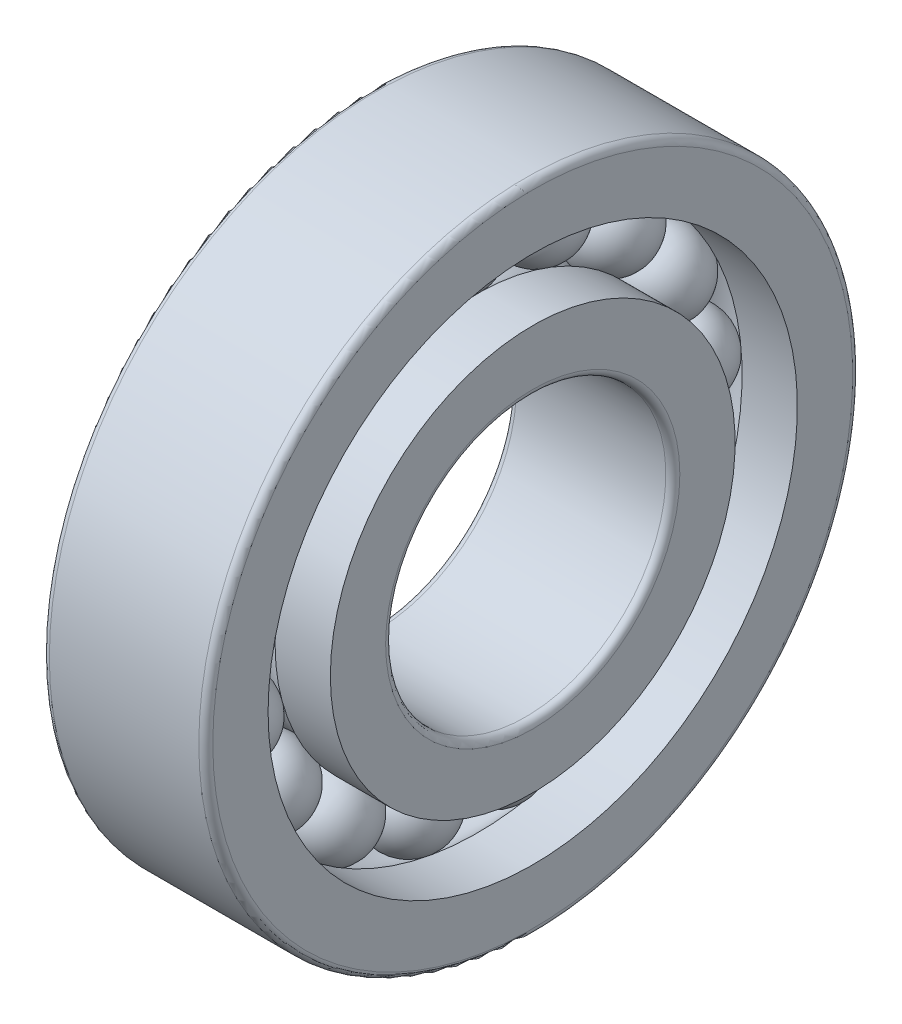
from build123d import *

# Parameters (mm, degrees)
PATTERN_CIRCULAR_5_COUNT = 17


with BuildPart() as part:
    # 草图2 → 旋转1 (revolve)
    with BuildSketch(Plane.XY):
        with BuildLine():
            Line((-3.35, 8.666666667), (-3.5, 8.666666667))
            Line((-3.5, 8.666666667), (-3.5, 8.366666667))
            Line((-3.5, 8.366666667), (-3.5, 6.3))
            ThreePointArc((-3.5, 6.3), (-3.412132034, 6.087867966), (-3.2, 6))
            Line((-3.2, 6), (3.2, 6))
            ThreePointArc((3.2, 6), (3.412132034, 6.087867966), (3.5, 6.3))
            Line((3.5, 6.3), (3.5, 8.366666667))
            Line((3.5, 8.366666667), (3.5, 8.666666667))
            Line((3.5, 8.666666667), (3.2, 8.666666667))
            Line((3.2, 8.666666667), (1.133455876, 8.666666667))
            ThreePointArc((1.133455876, 8.666666667), (0, 8.25), (-1.133455876, 8.666666667))
            Line((-1.133455876, 8.666666667), (-2.75, 8.666666667))
            Line((-2.75, 8.666666667), (-2.75, 8.366666667))
            Line((-2.75, 8.366666667), (-3.05, 8.366666667))
            Line((-3.05, 8.366666667), (-3.35, 8.666666667))
        make_face()
        with BuildLine():
            Line((-3.5, 11.333333333), (-3.35, 11.333333333))
            Line((-3.35, 11.333333333), (-3.05, 11.633333333))
            Line((-3.05, 11.633333333), (-2.75, 11.633333333))
            Line((-2.75, 11.633333333), (-2.75, 11.333333333))
            Line((-2.75, 11.333333333), (-1.133455876, 11.333333333))
            ThreePointArc((-1.133455876, 11.333333333), (0, 11.75), (1.133455876, 11.333333333))
            Line((1.133455876, 11.333333333), (3.5, 11.333333333))
            Line((3.5, 11.333333333), (3.5, 13.7))
            ThreePointArc((3.5, 13.7), (3.412132034, 13.912132034), (3.2, 14))
            Line((3.2, 14), (-3.2, 14))
            ThreePointArc((-3.2, 14), (-3.412132034, 13.912132034), (-3.5, 13.7))
            Line((-3.5, 13.7), (-3.5, 11.333333333))
        make_face()
    revolve(axis=Axis((-3.5, 0, 0), (1, 0, 0)))


with BuildPart() as body_2:
    # 草图3 → 旋转2 (revolve)
    with BuildSketch(Plane.XY):
        with BuildLine():
            ThreePointArc((1.75, 10), (0, 11.75), (-1.75, 10))
            Line((-1.75, 10), (1.75, 10))
        make_face()
    revolve(axis=Axis((1.75, 10, 0), (1, 0, 0)))


with BuildPart() as body_3:
    # 草图4 → 旋转3 (revolve)
    with BuildSketch(Plane.XY):
        Polygon((-3.35, 11.333333333), (-3.35, 8.666666667), (-3.05, 8.366666667), (-2.75, 8.366666667), (-2.75, 8.666666667), (-3.05, 8.966666667), (-3.05, 11.033333333), (-2.75, 11.333333333), (-2.75, 11.633333333), (-3.05, 11.633333333), align=None)
    revolve(axis=Axis((-19.927092192, 0, 0), (1, 0, 0)))


with BuildPart() as pattern_circular_5_1:
    # 阵列(圆周)5: pattern copy
    add(body_2.part.rotate(Axis((9.9, 0, 0), (-1, 0, 0)), 1 * 360 / PATTERN_CIRCULAR_5_COUNT))


with BuildPart() as pattern_circular_5_2:
    # 阵列(圆周)5: pattern copy
    add(body_2.part.rotate(Axis((9.9, 0, 0), (-1, 0, 0)), 2 * 360 / PATTERN_CIRCULAR_5_COUNT))


with BuildPart() as pattern_circular_5_3:
    # 阵列(圆周)5: pattern copy
    add(body_2.part.rotate(Axis((9.9, 0, 0), (-1, 0, 0)), 3 * 360 / PATTERN_CIRCULAR_5_COUNT))


with BuildPart() as pattern_circular_5_4:
    # 阵列(圆周)5: pattern copy
    add(body_2.part.rotate(Axis((9.9, 0, 0), (-1, 0, 0)), 4 * 360 / PATTERN_CIRCULAR_5_COUNT))


with BuildPart() as pattern_circular_5_5:
    # 阵列(圆周)5: pattern copy
    add(body_2.part.rotate(Axis((9.9, 0, 0), (-1, 0, 0)), 5 * 360 / PATTERN_CIRCULAR_5_COUNT))


with BuildPart() as pattern_circular_5_6:
    # 阵列(圆周)5: pattern copy
    add(body_2.part.rotate(Axis((9.9, 0, 0), (-1, 0, 0)), 6 * 360 / PATTERN_CIRCULAR_5_COUNT))


with BuildPart() as pattern_circular_5_7:
    # 阵列(圆周)5: pattern copy
    add(body_2.part.rotate(Axis((9.9, 0, 0), (-1, 0, 0)), 7 * 360 / PATTERN_CIRCULAR_5_COUNT))


with BuildPart() as pattern_circular_5_8:
    # 阵列(圆周)5: pattern copy
    add(body_2.part.rotate(Axis((9.9, 0, 0), (-1, 0, 0)), 8 * 360 / PATTERN_CIRCULAR_5_COUNT))


with BuildPart() as pattern_circular_5_9:
    # 阵列(圆周)5: pattern copy
    add(body_2.part.rotate(Axis((9.9, 0, 0), (-1, 0, 0)), 9 * 360 / PATTERN_CIRCULAR_5_COUNT))


with BuildPart() as pattern_circular_5_10:
    # 阵列(圆周)5: pattern copy
    add(body_2.part.rotate(Axis((9.9, 0, 0), (-1, 0, 0)), 10 * 360 / PATTERN_CIRCULAR_5_COUNT))


with BuildPart() as pattern_circular_5_11:
    # 阵列(圆周)5: pattern copy
    add(body_2.part.rotate(Axis((9.9, 0, 0), (-1, 0, 0)), 11 * 360 / PATTERN_CIRCULAR_5_COUNT))


with BuildPart() as pattern_circular_5_12:
    # 阵列(圆周)5: pattern copy
    add(body_2.part.rotate(Axis((9.9, 0, 0), (-1, 0, 0)), 12 * 360 / PATTERN_CIRCULAR_5_COUNT))


with BuildPart() as pattern_circular_5_13:
    # 阵列(圆周)5: pattern copy
    add(body_2.part.rotate(Axis((9.9, 0, 0), (-1, 0, 0)), 13 * 360 / PATTERN_CIRCULAR_5_COUNT))


with BuildPart() as pattern_circular_5_14:
    # 阵列(圆周)5: pattern copy
    add(body_2.part.rotate(Axis((9.9, 0, 0), (-1, 0, 0)), 14 * 360 / PATTERN_CIRCULAR_5_COUNT))


with BuildPart() as pattern_circular_5_15:
    # 阵列(圆周)5: pattern copy
    add(body_2.part.rotate(Axis((9.9, 0, 0), (-1, 0, 0)), 15 * 360 / PATTERN_CIRCULAR_5_COUNT))


with BuildPart() as pattern_circular_5_16:
    # 阵列(圆周)5: pattern copy
    add(body_2.part.rotate(Axis((9.9, 0, 0), (-1, 0, 0)), 16 * 360 / PATTERN_CIRCULAR_5_COUNT))


solid = Compound([part.part, body_2.part, body_3.part, pattern_circular_5_1.part, pattern_circular_5_2.part, pattern_circular_5_3.part, pattern_circular_5_4.part, pattern_circular_5_5.part, pattern_circular_5_6.part, pattern_circular_5_7.part, pattern_circular_5_8.part, pattern_circular_5_9.part, pattern_circular_5_10.part, pattern_circular_5_11.part, pattern_circular_5_12.part, pattern_circular_5_13.part, pattern_circular_5_14.part, pattern_circular_5_15.part, pattern_circular_5_16.part])
